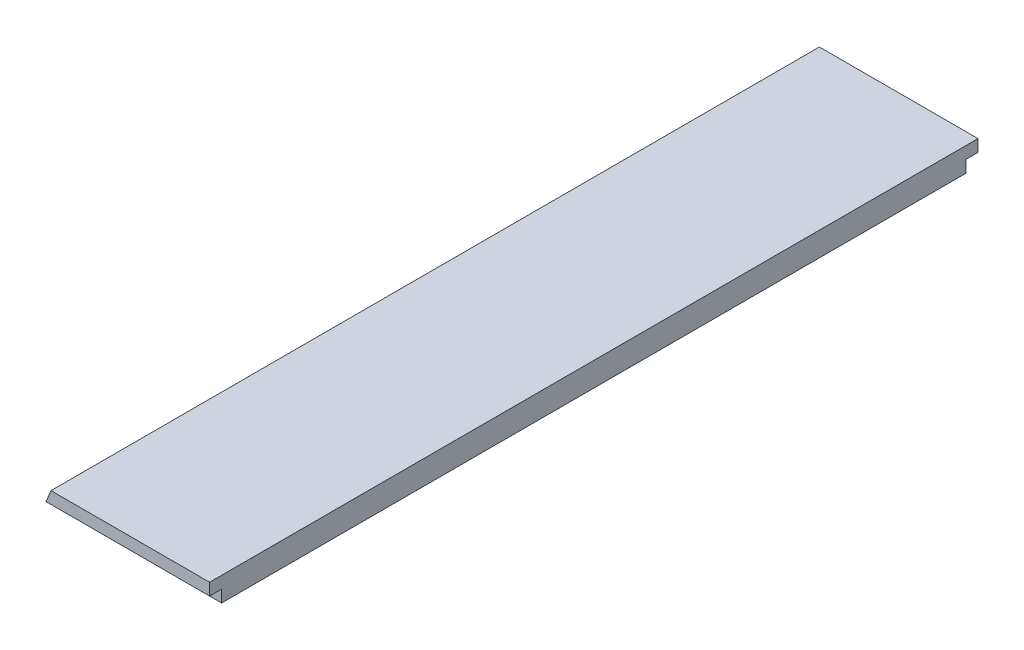
from build123d import *

# Parameters (mm, degrees)
BOSS_EXTRUDE1_DEPTH = 406.4
SKETCH2_W           = 89.154
SKETCH2_H           = 6.35
CUT_EXTRUDE1_DEPTH  = 6.35


with BuildPart() as part:
    # Sketch1 → Boss-Extrude1 (new body)
    with BuildSketch(Plane.XY):
        Polygon((0, 0), (5.260512242, 12.7), (89.154, 12.7), (89.154, 0), align=None)
    extrude(amount=BOSS_EXTRUDE1_DEPTH)

    # Sketch2 → Cut-Extrude1 (cut)
    with BuildSketch(Plane.XZ):
        with Locations((44.577, 3.175)):
            Rectangle(SKETCH2_W, SKETCH2_H)
        with Locations((44.577, 403.225)):
            Rectangle(SKETCH2_W, SKETCH2_H)
    extrude(amount=-CUT_EXTRUDE1_DEPTH, mode=Mode.SUBTRACT)


solid = part.part
